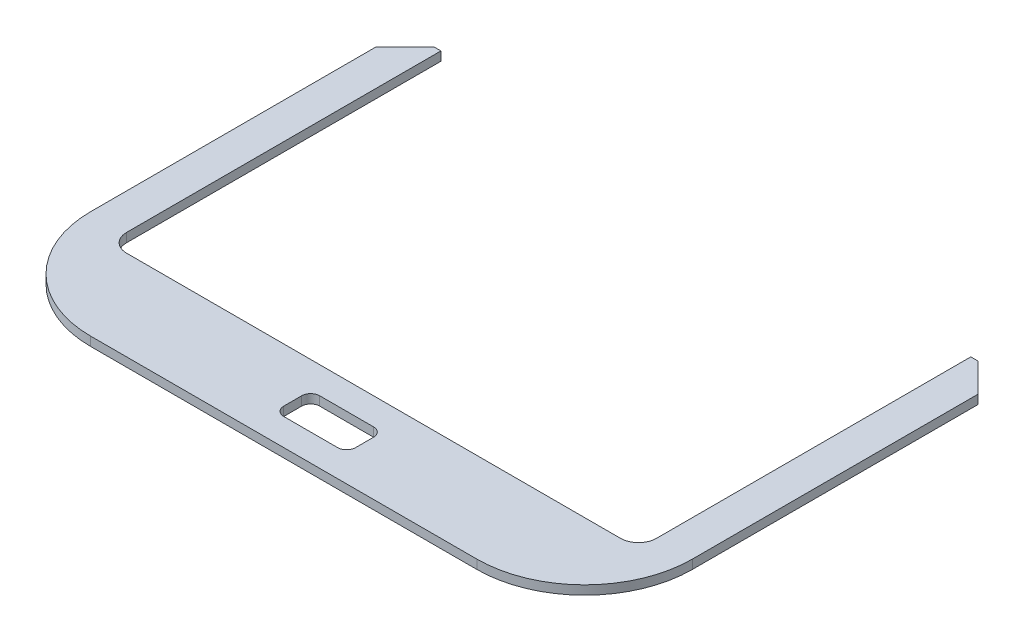
from build123d import *

# Parameters (mm, degrees)
BOSS_EXTRUDE1_DEPTH     = 0.79375
FILLET1_R               = 19.05
CUT_EXTRUDE1_DEPTH      = 80.251873253
CUT_EXTRUDE1_DEPTH_BACK = 80.251873253
SKETCH2_W               = 12.7
SKETCH2_H               = 6.35
FILLET2_R               = 1.5875
CHAMFER1_SIZE           = 5.08
FILLET3_R               = 3.175


with BuildPart() as part:
    # Sketch1 → Boss-Extrude1 (new, symmetric)
    with BuildSketch(Plane(origin=(0, 0, 0), x_dir=(1, 0, 0), z_dir=(0, 1, 0))):
        Polygon((-46.83125, 58.7375), (-46.83125, 0), (46.83125, 0), (46.83125, 58.7375), (53.18125, 58.7375), (53.18125, -15.875), (-53.18125, -15.875), (-53.18125, 58.7375), align=None)
    extrude(amount=BOSS_EXTRUDE1_DEPTH, both=True)

    # Fillet1
    fillet1_edges = [part.edges().sort_by_distance(p)[0] for p in [
        (53.18125, 0, 15.875),
        (-53.18125, 0, 15.875),
    ]]
    fillet(fillet1_edges, radius=FILLET1_R)

    # Sketch2 → Cut-Extrude1 (cut, two sides: drawn at the far end of the back side and taken through both)
    with BuildSketch(Plane(origin=(0, 0.79375, 0), x_dir=(1, 0, 0), z_dir=(0, 1, 0)).offset(-CUT_EXTRUDE1_DEPTH_BACK)):
        with Locations((0, -7.9375)):
            Rectangle(SKETCH2_W, SKETCH2_H)
    extrude(amount=CUT_EXTRUDE1_DEPTH + CUT_EXTRUDE1_DEPTH_BACK, mode=Mode.SUBTRACT)

    # Fillet2
    fillet2_edges = [part.edges().sort_by_distance(p)[0] for p in [
        (6.35, 0, 4.7625),
        (6.35, 0, 11.1125),
        (-6.35, 0, 11.1125),
        (-6.35, 0, 4.7625),
    ]]
    fillet(fillet2_edges, radius=FILLET2_R)

    # Chamfer1
    chamfer1_edges = [part.edges().sort_by_distance(p)[0] for p in [
        (-53.18125, 0, -58.7375),
        (53.18125, 0, -58.7375),
    ]]
    chamfer(chamfer1_edges, length=CHAMFER1_SIZE)

    # Fillet3
    fillet3_edges = [part.edges().sort_by_distance(p)[0] for p in [
        (-46.83125, 0, 0),
        (46.83125, 0, 0),
    ]]
    fillet(fillet3_edges, radius=FILLET3_R)


solid = part.part
